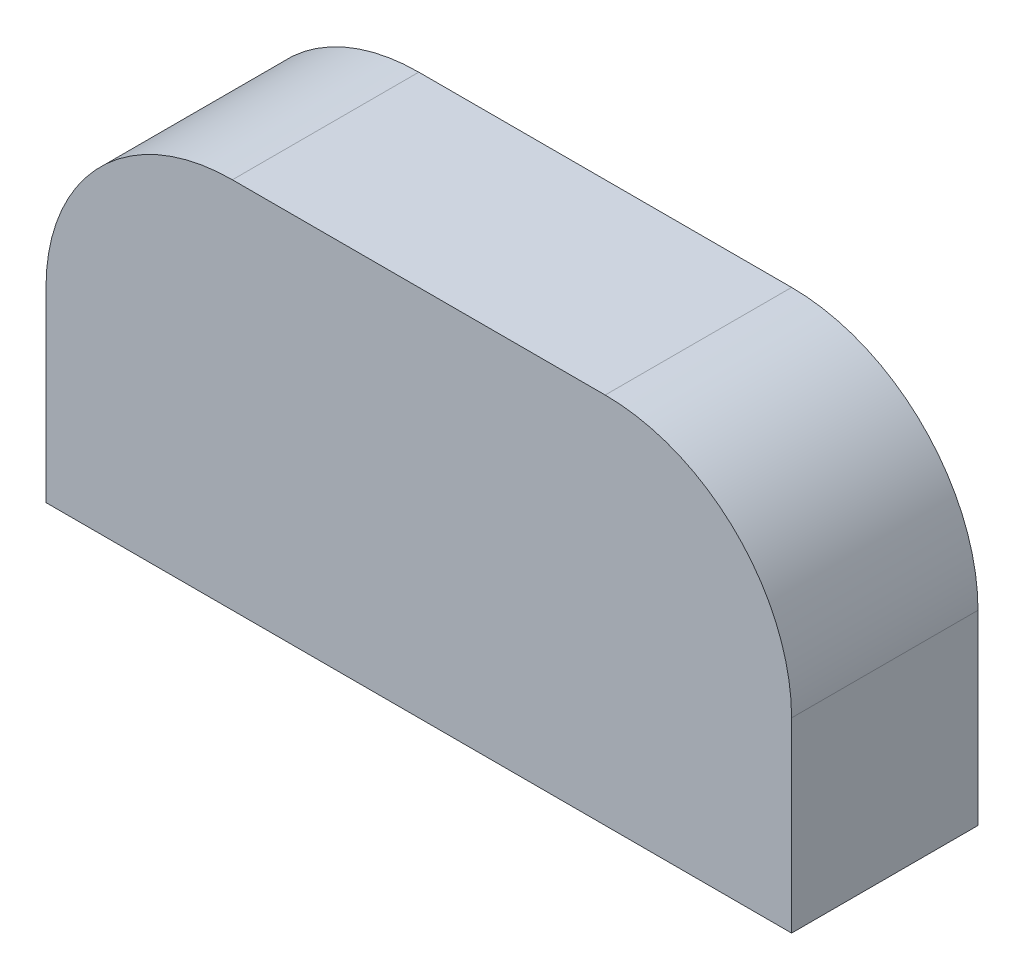
from build123d import *

# Parameters (mm, degrees)
ESQUISSE2_W        = 25.4
ESQUISSE2_H        = 12.7
BOSS_EXTRU_1_DEPTH = 6.35
CONG_1_R           = 6.35


with BuildPart() as part:
    # Esquisse2 → Boss.-Extru.1 (new body)
    with BuildSketch(Plane.XY):
        Rectangle(ESQUISSE2_W, ESQUISSE2_H)
    extrude(amount=BOSS_EXTRU_1_DEPTH)

    # Congé1
    cong_1_edges = [part.edges().sort_by_distance(p)[0] for p in [
        (-12.7, 6.35, 3.175),
        (12.7, 6.35, 3.175),
    ]]
    fillet(cong_1_edges, radius=CONG_1_R)


solid = part.part
